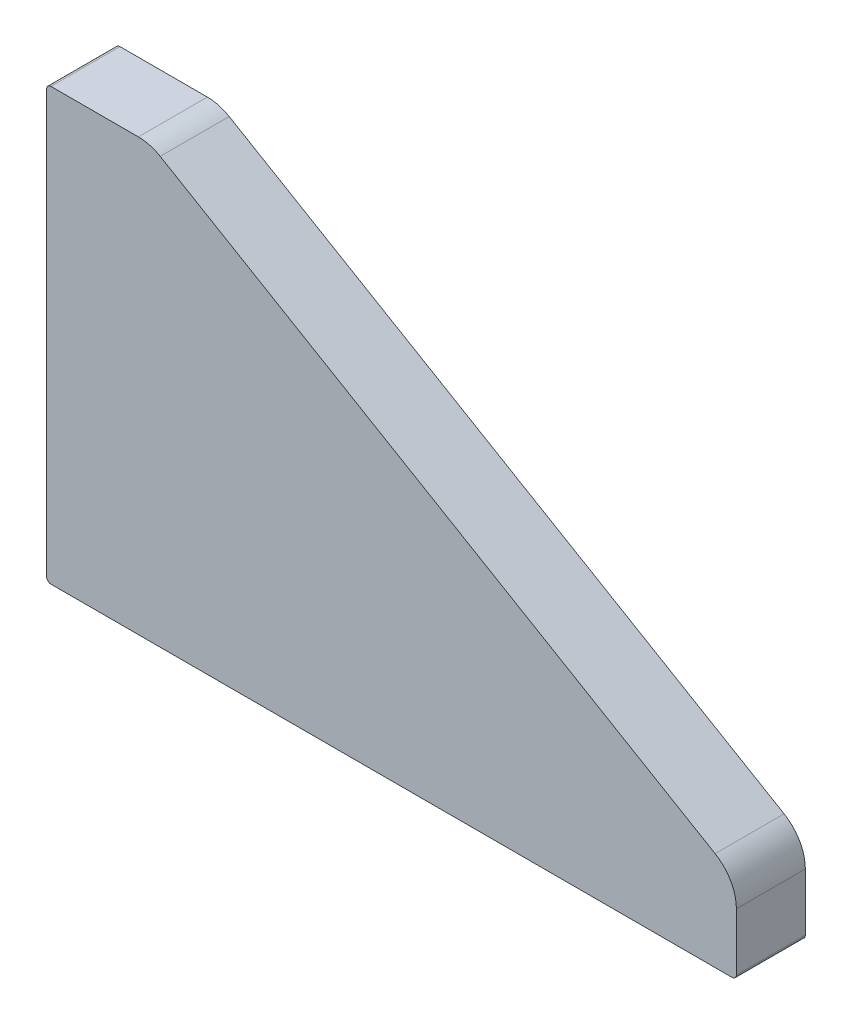
from build123d import *

# Parameters (mm, degrees)
BOSS_EXTRUDE1_DEPTH   = 8
FILLET1_R             = 5
FILLET3_R             = 0.5
M4_TAPPED_HOLE1_D     = 3.3
M4_TAPPED_HOLE1_DEPTH = 14.6
M4_TAPPED_HOLE1_TIP   = 0.991420021
M4_TAPPED_HOLE2_D     = 3.3
M4_TAPPED_HOLE2_DEPTH = 14.6
M4_TAPPED_HOLE2_TIP   = 0.991420021


with BuildPart() as part:
    # Sketch1 → Boss-Extrude1 (new body)
    with BuildSketch(Plane.XY):
        Polygon((0, 0), (80, 0), (80, 10), (12, 50), (0, 50), align=None)
    extrude(amount=BOSS_EXTRUDE1_DEPTH)

    # Fillet1
    fillet1_edges = [part.edges().sort_by_distance(p)[0] for p in [
        (12, 50, 4),
        (80, 10, 4),
    ]]
    fillet(fillet1_edges, radius=FILLET1_R)

    # Fillet3
    fillet3_edges = [part.edges().sort_by_distance(p)[0] for p in [
        (0, 50, 4),
        (80, 0, 4),
        (0, 0, 4),
    ]]
    fillet(fillet3_edges, radius=FILLET3_R)

    # M4 Tapped Hole1
    with Locations(Plane.ZY):
        with Locations((4, 43.5), (4, 6)):
            Hole(M4_TAPPED_HOLE1_D / 2, depth=M4_TAPPED_HOLE1_DEPTH)
            with Locations((0, 0, -(M4_TAPPED_HOLE1_DEPTH + M4_TAPPED_HOLE1_TIP / 2))):  # 118° drill point
                Cone(0, M4_TAPPED_HOLE1_D / 2, M4_TAPPED_HOLE1_TIP, mode=Mode.SUBTRACT)

    # M4 Tapped Hole2
    with Locations(Plane(origin=(0, 0, 0), x_dir=(-1, 0, 0), z_dir=(0, -1, 0))):
        with Locations((-20, -4), (-65, -4)):
            Hole(M4_TAPPED_HOLE2_D / 2, depth=M4_TAPPED_HOLE2_DEPTH)
            with Locations((0, 0, -(M4_TAPPED_HOLE2_DEPTH + M4_TAPPED_HOLE2_TIP / 2))):  # 118° drill point
                Cone(0, M4_TAPPED_HOLE2_D / 2, M4_TAPPED_HOLE2_TIP, mode=Mode.SUBTRACT)


solid = part.part
